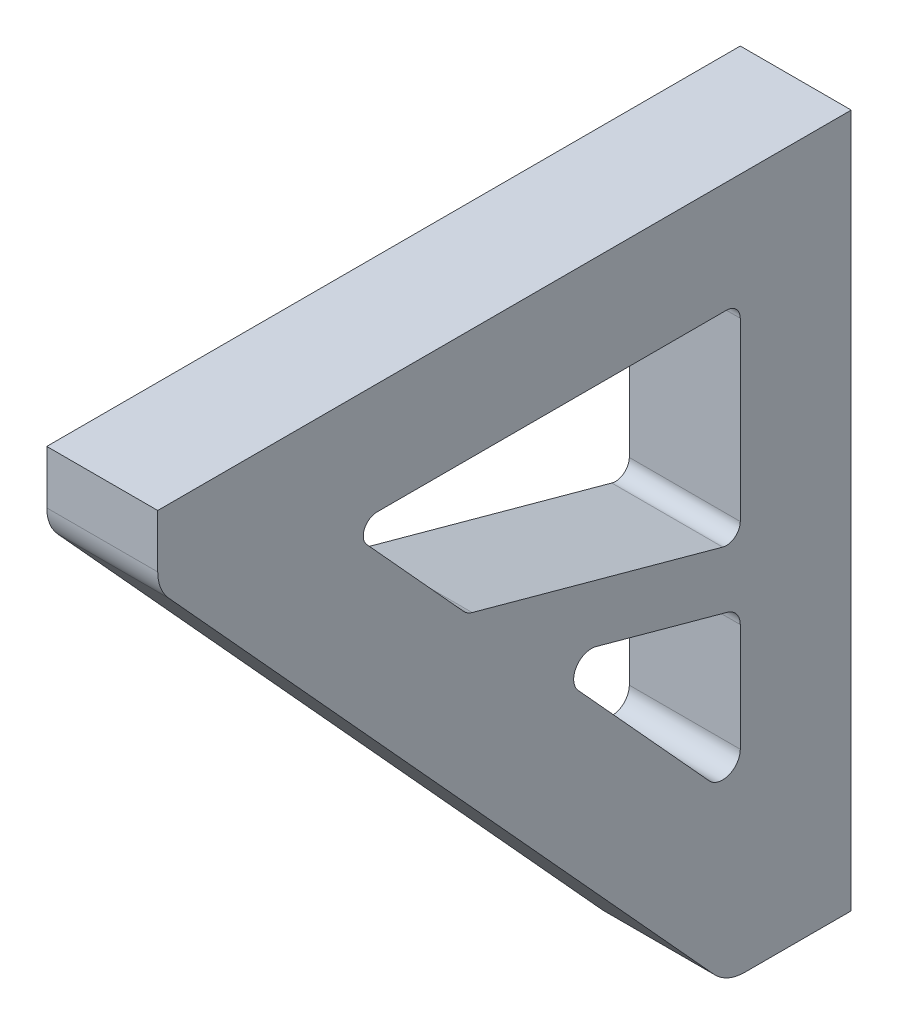
from build123d import *

# Parameters (mm, degrees)
SKETCH1_W           = 8
SKETCH1_H           = 50
BOSS_EXTRUDE1_DEPTH = 50
CUT_EXTRUDE1_DEPTH  = 72.161787499
FILLET1_R           = 3


with BuildPart() as part:
    # Sketch1 → Boss-Extrude1 (new body)
    with BuildSketch(Plane.XY):
        with Locations((4, 25)):
            Rectangle(SKETCH1_W, SKETCH1_H)
    extrude(amount=BOSS_EXTRUDE1_DEPTH)

    # Sketch2 → Cut-Extrude1 (cut, through all)
    with BuildSketch(Plane.ZY):
        Polygon((9, 0), (50, 45), (50, 0), align=None)
        with BuildLine():
            Line((34.919366889, 40.326510004), (27.939173676, 32.665322332))
            ThreePointArc((27.939173676, 32.665322332), (27.661132031, 32.43550968), (27.330075217, 32.292253277))
            Line((27.330075217, 32.292253277), (9.264065377, 27.346080088))
            ThreePointArc((9.264065377, 27.346080088), (8.393396908, 27.515580036), (8, 28.310584871))
            Line((8, 28.310584871), (8, 41))
            ThreePointArc((8, 41), (8.292893219, 41.707106781), (9, 42))
            Line((9, 42), (34.180170551, 42))
            ThreePointArc((34.180170551, 42), (35.094908218, 41.404048267), (34.919366889, 40.326510004))
        make_face()
        with BuildLine():
            Line((19.677865993, 23.598033411), (10.229578577, 13.227961857))
            ThreePointArc((10.229578577, 13.227961857), (8.819028368, 12.895892811), (8, 14.091348489))
            Line((8, 14.091348489), (8, 21.874636004))
            ThreePointArc((8, 21.874636004), (8.262795417, 22.65227636), (8.943438089, 23.111091691))
            Line((8.943438089, 23.111091691), (18.391725505, 25.697875729))
            ThreePointArc((18.391725505, 25.697875729), (19.823445803, 25.130997871), (19.677865993, 23.598033411))
        make_face()
    extrude(amount=-CUT_EXTRUDE1_DEPTH, mode=Mode.SUBTRACT)

    # Fillet1
    fillet1_edges = [part.edges().sort_by_distance(p)[0] for p in [
        (4, 0, 9),
        (4, 45, 50),
    ]]
    fillet(fillet1_edges, radius=FILLET1_R)


solid = part.part
